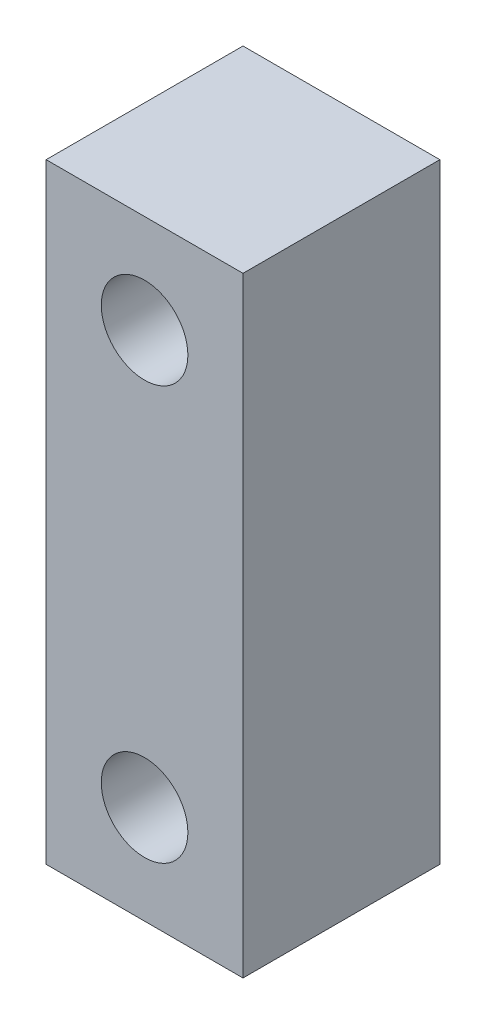
from build123d import *

# Parameters (mm, degrees)
SKETCH1_W           = 10
SKETCH1_H           = 31
SKETCH1_R           = 2.2
BOSS_EXTRUDE1_DEPTH = 10


with BuildPart() as part:
    # Sketch1 → Boss-Extrude1 (new body)
    with BuildSketch(Plane(origin=(0, 0, -25), x_dir=(-1, 0, 0), z_dir=(0, 0, -1))):
        with Locations((0, 10.5)):
            Rectangle(SKETCH1_W, SKETCH1_H)
        with Locations(Location((0, 0, 0), (0, 0, 180))):
            Circle(SKETCH1_R, mode=Mode.SUBTRACT)
        with Locations(Location((0, 21, 0), (0, 0, 180))):
            Circle(SKETCH1_R, mode=Mode.SUBTRACT)
    extrude(amount=-BOSS_EXTRUDE1_DEPTH)


solid = part.part
